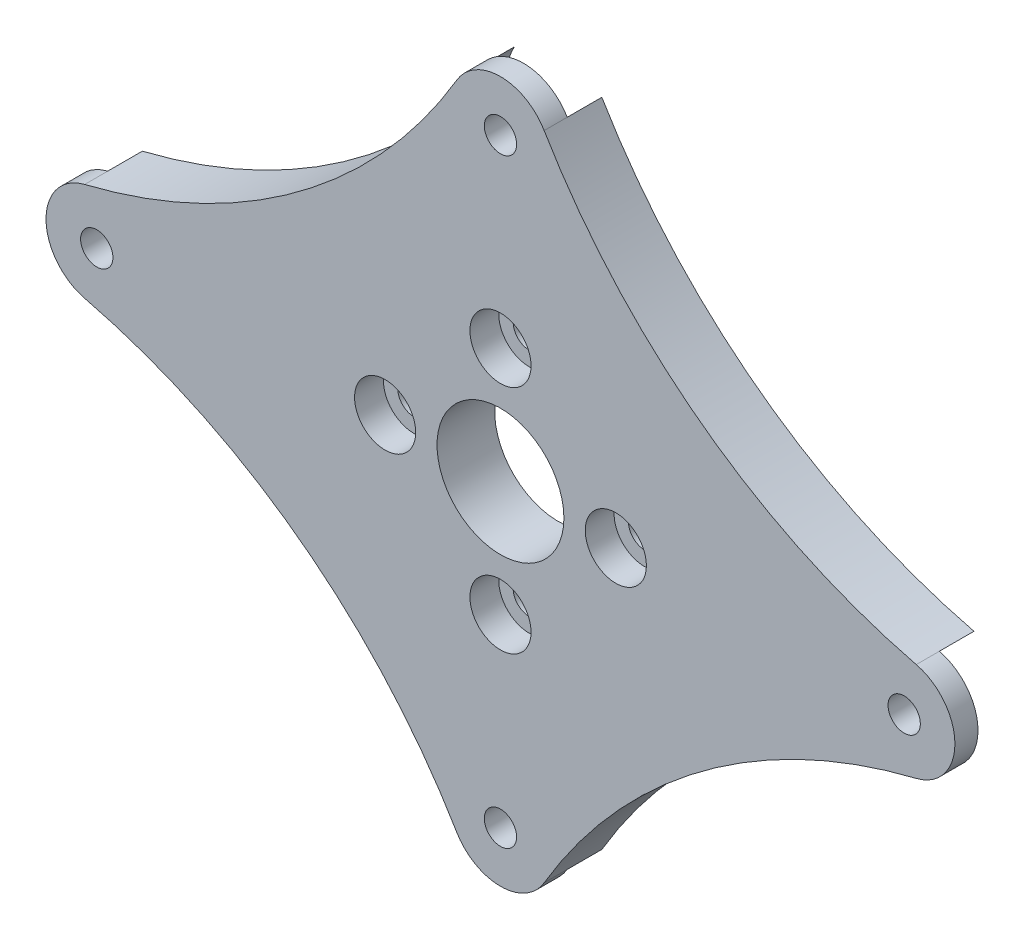
from build123d import *

# Parameters (mm, degrees)
SKETCH1_R           = 5.5
SKETCH1_R_2         = 1.4
BOSS_EXTRUDE1_DEPTH = 5
SKETCH2_R           = 2.65
CUT_EXTRUDE1_DEPTH  = 2.5
SKETCH3_R           = 4.4
CUT_EXTRUDE2_DEPTH  = 3


with BuildPart() as part:
    # Sketch1 → Boss-Extrude1 (new body)
    with BuildSketch(Plane.XY):
        with BuildLine():
            ThreePointArc((-3.788390561, 28.237877779), (0, 30.4), (3.788390561, 28.237877779))
            ThreePointArc((3.788390561, 28.237877779), (17.5, 13), (36.048454046, 4.273259191))
            ThreePointArc((36.048454046, 4.273259191), (39.4, 0), (36.048454046, -4.273259191))
            ThreePointArc((36.048454046, -4.273259191), (17.5, -13), (3.788390561, -28.237877779))
            ThreePointArc((3.788390561, -28.237877779), (0, -30.4), (-3.788390561, -28.237877779))
            ThreePointArc((-3.788390561, -28.237877779), (-17.5, -13), (-36.048454046, -4.273259191))
            ThreePointArc((-36.048454046, -4.273259191), (-39.4, 0), (-36.048454046, 4.273259191))
            ThreePointArc((-36.048454046, 4.273259191), (-17.5, 13), (-3.788390561, 28.237877779))
        make_face()
        Circle(SKETCH1_R, mode=Mode.SUBTRACT)
        with Locations((0, 10)):
            Circle(SKETCH1_R_2, mode=Mode.SUBTRACT)
        with Locations((10, 0)):
            Circle(SKETCH1_R_2, mode=Mode.SUBTRACT)
        with Locations((0, -10)):
            Circle(SKETCH1_R_2, mode=Mode.SUBTRACT)
        with Locations((-10, 0)):
            Circle(SKETCH1_R_2, mode=Mode.SUBTRACT)
        with Locations((35, 0)):
            Circle(SKETCH1_R_2, mode=Mode.SUBTRACT)
        with Locations((0, 26)):
            Circle(SKETCH1_R_2, mode=Mode.SUBTRACT)
        with Locations((0, -26)):
            Circle(SKETCH1_R_2, mode=Mode.SUBTRACT)
        with Locations((-35, 0)):
            Circle(SKETCH1_R_2, mode=Mode.SUBTRACT)
    extrude(amount=BOSS_EXTRUDE1_DEPTH)

    # Sketch2 → Cut-Extrude1 (cut)
    with BuildSketch(Plane.XY.offset(5)):
        with Locations((0, 10)):
            Circle(SKETCH2_R)
        with Locations((10, 0)):
            Circle(SKETCH2_R)
        with Locations((0, -10)):
            Circle(SKETCH2_R)
        with Locations((-10, 0)):
            Circle(SKETCH2_R)
    extrude(amount=-CUT_EXTRUDE1_DEPTH, mode=Mode.SUBTRACT)

    # Sketch3 → Cut-Extrude2 (cut)
    with BuildSketch(Plane(origin=(0, 0, 0), x_dir=(-1, 0, 0), z_dir=(0, 0, -1))):
        with Locations((0, 26)):
            Circle(SKETCH3_R)
        with Locations((35, 0)):
            Circle(SKETCH3_R)
        with Locations((0, -26)):
            Circle(SKETCH3_R)
        with Locations((-35, 0)):
            Circle(SKETCH3_R)
    extrude(amount=-CUT_EXTRUDE2_DEPTH, mode=Mode.SUBTRACT)


solid = part.part
